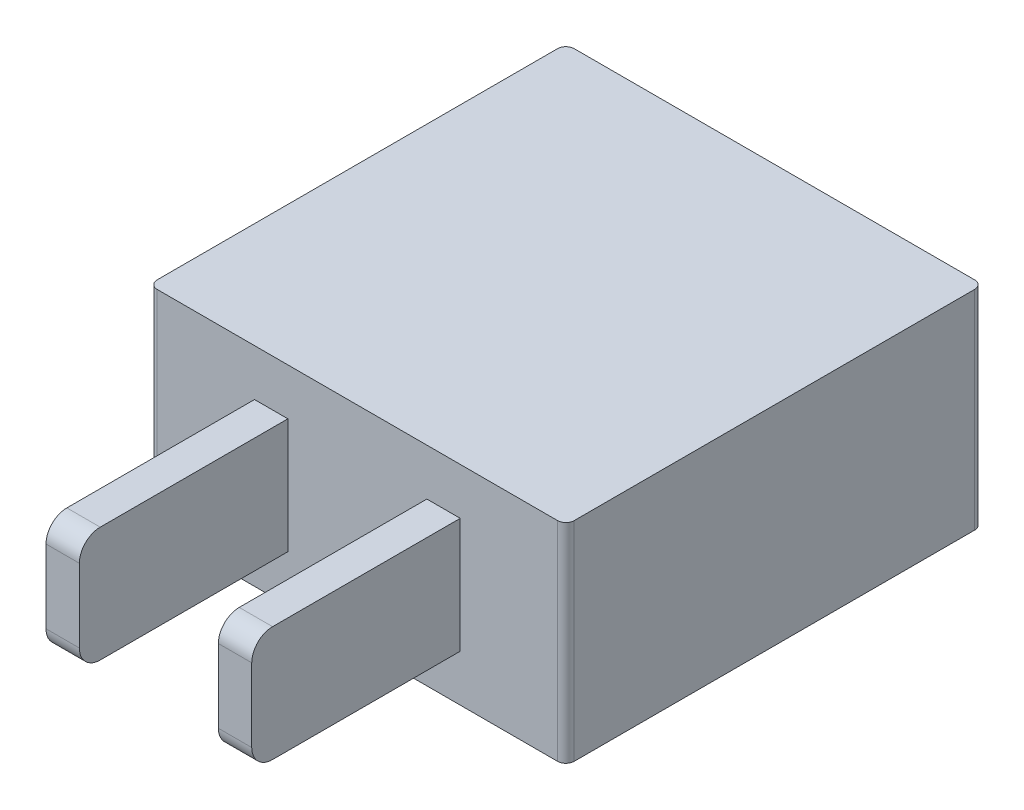
from build123d import *

# Parameters (mm, degrees)
SKETCH1_W           = 12.7
SKETCH1_H           = 12.7
BOSS_EXTRUDE1_DEPTH = 6.35
SKETCH2_W           = 1.016
SKETCH2_H           = 3.5052
BOSS_EXTRUDE2_DEPTH = 6.35
FILLET1_R           = 0.635
FILLET2_R           = 0.254


with BuildPart() as part:
    # Sketch1 → Boss-Extrude1 (new body)
    with BuildSketch(Plane(origin=(0, 0, 0), x_dir=(1, 0, 0), z_dir=(0, 1, 0))):
        Rectangle(SKETCH1_W, SKETCH1_H)
    extrude(amount=BOSS_EXTRUDE1_DEPTH)

    # Sketch2 → Boss-Extrude2 (add)
    with BuildSketch(Plane.XY.offset(6.35)):
        with Locations((-2.624666667, 3.175)):
            Rectangle(SKETCH2_W, SKETCH2_H)
        with Locations((2.624666667, 3.175)):
            Rectangle(SKETCH2_W, SKETCH2_H)
    extrude(amount=BOSS_EXTRUDE2_DEPTH)

    # Fillet1
    fillet1_edges = [part.edges().sort_by_distance(p)[0] for p in [
        (-2.624666667, 1.4224, 12.7),
        (-2.624666667, 4.9276, 12.7),
        (2.624666667, 4.9276, 12.7),
        (2.624666667, 1.4224, 12.7),
    ]]
    fillet(fillet1_edges, radius=FILLET1_R)

    # Fillet2
    fillet2_edges = [part.edges().sort_by_distance(p)[0] for p in [
        (6.35, 3.175, 6.35),
        (-6.35, 3.175, 6.35),
        (-6.35, 3.175, -6.35),
        (6.35, 3.175, -6.35),
    ]]
    fillet(fillet2_edges, radius=FILLET2_R)


solid = part.part
